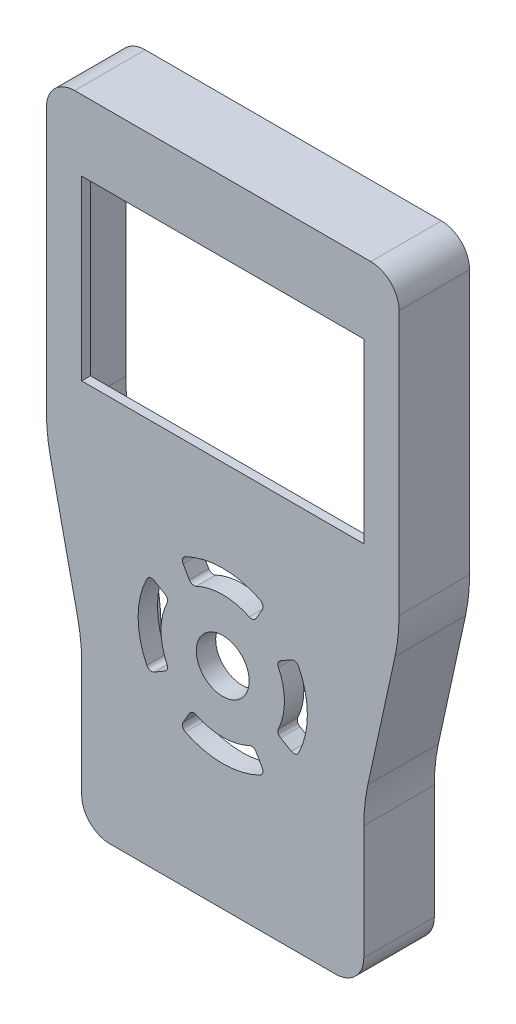
from build123d import *

# Parameters (mm, degrees)
ESBO_O1_W                = 100
ESBO_O1_H                = 180
ESBO_O1_R                = 24
ESBO_O1_W_2              = 80
ESBO_O1_H_2              = 50.3
RESSALTO_EXTRUS_O1_DEPTH = 20
CORTE_EXTRUS_O1_DEPTH    = 227.2
FILETE1_R                = 50
FILETE2_R                = 8
FILETE3_R                = 1.5
CASCA1_T                 = -2.5
CORTE_EXTRUS_O2_START    = 108.4
ESBO_O3_R                = 26.5
CORTE_EXTRUS_O2_DEPTH    = 105.4
ESBO_O4_W                = 85
ESBO_O4_H                = 55.3
CORTE_EXTRUS_O3_DEPTH    = 17.5


with BuildPart() as part:
    # Esboço1 → Ressalto-extrusão1 (new body)
    # profile 1 of 13: a face of its own
    with BuildSketch(Plane.XY):
        with Locations((50, 90)):
            Rectangle(ESBO_O1_W, ESBO_O1_H)
        with Locations((50, 59.7)):
            Circle(ESBO_O1_R, mode=Mode.SUBTRACT)
        with Locations((50, 134.85)):
            Rectangle(ESBO_O1_W_2, ESBO_O1_H_2, mode=Mode.SUBTRACT)
    # profile 2 of 13: a face of its own
    with BuildSketch(Plane.XY):
        with BuildLine():
            ThreePointArc((58.75, 74.855444566), (50, 77.2), (41.25, 74.855444566))
            Line((41.25, 74.855444566), (46.25, 66.195190528))
            ThreePointArc((46.25, 66.195190528), (50, 67.2), (53.75, 66.195190528))
            Line((53.75, 66.195190528), (58.75, 74.855444566))
        make_face()
    # profile 3 of 13: a face of its own
    with BuildSketch(Plane.XY):
        with BuildLine():
            Line((46.25, 66.195190528), (41.25, 74.855444566))
            ThreePointArc((41.25, 74.855444566), (37.625631329, 72.074368671), (34.844555434, 68.45))
            Line((34.844555434, 68.45), (43.504809472, 63.45))
            ThreePointArc((43.504809472, 63.45), (44.696699141, 65.003300859), (46.25, 66.195190528))
        make_face()
    # profile 4 of 13: a face of its own
    with BuildSketch(Plane.XY):
        with BuildLine():
            Line((43.504809472, 63.45), (34.844555434, 68.45))
            ThreePointArc((34.844555434, 68.45), (32.5, 59.7), (34.844555434, 50.95))
            Line((34.844555434, 50.95), (43.504809472, 55.95))
            ThreePointArc((43.504809472, 55.95), (42.5, 59.7), (43.504809472, 63.45))
        make_face()
    # profile 5 of 13: a face of its own
    with BuildSketch(Plane.XY):
        with BuildLine():
            Line((43.504809472, 55.95), (34.844555434, 50.95))
            ThreePointArc((34.844555434, 50.95), (37.625631329, 47.325631329), (41.25, 44.544555434))
            Line((41.25, 44.544555434), (46.25, 53.204809472))
            ThreePointArc((46.25, 53.204809472), (44.696699141, 54.396699141), (43.504809472, 55.95))
        make_face()
    # profile 6 of 13: a face of its own
    with BuildSketch(Plane.XY):
        with BuildLine():
            Line((58.75, 44.544555434), (53.75, 53.204809472))
            ThreePointArc((53.75, 53.204809472), (50, 52.2), (46.25, 53.204809472))
            Line((46.25, 53.204809472), (41.25, 44.544555434))
            ThreePointArc((41.25, 44.544555434), (50, 42.2), (58.75, 44.544555434))
        make_face()
    # profile 7 of 13: a face of its own
    with BuildSketch(Plane.XY):
        with BuildLine():
            ThreePointArc((67.5, 59.7), (66.90370196, 64.229333289), (65.155444566, 68.45))
            Line((65.155444566, 68.45), (56.495190528, 63.45))
            ThreePointArc((56.495190528, 63.45), (57.244443697, 61.641142838), (57.5, 59.7))
            ThreePointArc((57.5, 59.7), (57.244443697, 57.758857162), (56.495190528, 55.95))
            Line((56.495190528, 55.95), (65.155444566, 50.95))
            ThreePointArc((65.155444566, 50.95), (66.90370196, 55.170666711), (67.5, 59.7))
        make_face()
    # profile 8 of 13: a face of its own
    with BuildSketch(Plane.XY):
        with BuildLine():
            ThreePointArc((56.495190528, 55.95), (55.303300859, 54.396699141), (53.75, 53.204809472))
            Line((53.75, 53.204809472), (58.75, 44.544555434))
            ThreePointArc((58.75, 44.544555434), (62.374368671, 47.325631329), (65.155444566, 50.95))
            Line((65.155444566, 50.95), (56.495190528, 55.95))
        make_face()
    # profile 9 of 13: a face of its own
    with BuildSketch(Plane.XY):
        with BuildLine():
            ThreePointArc((65.155444566, 68.45), (62.374368671, 72.074368671), (58.75, 74.855444566))
            Line((58.75, 74.855444566), (53.75, 66.195190528))
            ThreePointArc((53.75, 66.195190528), (55.303300859, 65.003300859), (56.495190528, 63.45))
            Line((56.495190528, 63.45), (65.155444566, 68.45))
        make_face()
    # profile 10 of 13: a face of its own
    with BuildSketch(Plane.XY):
        with BuildLine():
            Line((41.25, 74.855444566), (38, 80.484609691))
            ThreePointArc((38, 80.484609691), (33.029437252, 76.670562748), (29.215390309, 71.7))
            Line((29.215390309, 71.7), (34.844555434, 68.45))
            ThreePointArc((34.844555434, 68.45), (37.625631329, 72.074368671), (41.25, 74.855444566))
        make_face()
    # profile 11 of 13: a face of its own
    with BuildSketch(Plane.XY):
        with BuildLine():
            Line((34.844555434, 50.95), (29.215390309, 47.7))
            ThreePointArc((29.215390309, 47.7), (33.029437252, 42.729437252), (38, 38.915390309))
            Line((38, 38.915390309), (41.25, 44.544555434))
            ThreePointArc((41.25, 44.544555434), (37.625631329, 47.325631329), (34.844555434, 50.95))
        make_face()
    # profile 12 of 13: a face of its own
    with BuildSketch(Plane.XY):
        with BuildLine():
            ThreePointArc((62, 38.915390309), (66.970562748, 42.729437252), (70.784609691, 47.7))
            Line((70.784609691, 47.7), (65.155444566, 50.95))
            ThreePointArc((65.155444566, 50.95), (62.374368671, 47.325631329), (58.75, 44.544555434))
            Line((58.75, 44.544555434), (62, 38.915390309))
        make_face()
    # profile 13 of 13: a face of its own
    with BuildSketch(Plane.XY):
        with BuildLine():
            ThreePointArc((70.784609691, 71.7), (66.970562748, 76.670562748), (62, 80.484609691))
            Line((62, 80.484609691), (58.75, 74.855444566))
            ThreePointArc((58.75, 74.855444566), (62.374368671, 72.074368671), (65.155444566, 68.45))
            Line((65.155444566, 68.45), (70.784609691, 71.7))
        make_face()
    extrude(amount=RESSALTO_EXTRUS_O1_DEPTH)

    # Esboço2 → Corte-extrusão1 (cut)
    with BuildSketch(Plane.XY.offset(20)):
        Polygon((10, 45.85), (0, 91.7), (0, 0), (10, 0), align=None)
        Polygon((90, 45.85), (90, 0), (100, 0), (100, 91.7), align=None)
    extrude(amount=-CORTE_EXTRUS_O1_DEPTH, mode=Mode.SUBTRACT)

    # Filete1
    filete1_edges = [part.edges().sort_by_distance(p)[0] for p in [
        (90, 45.85, 10),
        (0, 91.7, 10),
        (10, 45.85, 10),
        (100, 91.7, 10),
    ]]
    fillet(filete1_edges, radius=FILETE1_R)

    # Filete2
    filete2_edges = [part.edges().sort_by_distance(p)[0] for p in [
        (90, 0, 10),
        (0, 180, 10),
        (100, 180, 10),
        (10, 0, 10),
    ]]
    fillet(filete2_edges, radius=FILETE2_R)

    # Filete3
    filete3_edges = [part.edges().sort_by_distance(p)[0] for p in [
        (58.75, 74.855444566, 10),
        (62, 80.484609691, 10),
        (38, 80.484609691, 10),
        (41.25, 74.855444566, 10),
        (34.844555434, 68.45, 10),
        (29.215390309, 71.7, 10),
        (29.215390309, 47.7, 10),
        (34.844555434, 50.95, 10),
        (70.784609691, 47.7, 10),
        (70.784609691, 71.7, 10),
        (65.155444566, 68.45, 10),
        (65.155444566, 50.95, 10),
        (41.25, 44.544555434, 10),
        (38, 38.915390309, 10),
        (62, 38.915390309, 10),
        (58.75, 44.544555434, 10),
    ]]
    fillet(filete3_edges, radius=FILETE3_R)

    # Casca1
    casca1_openings = [part.faces().sort_by_distance(p)[0] for p in [
        (50, 40.944516246, 0),
    ]]
    offset(amount=CASCA1_T, openings=casca1_openings, kind=Kind.INTERSECTION)

    # Esboço3 → Corte-extrusão2 (cut)
    with BuildSketch(Plane(origin=(0, 0, 17.5), x_dir=(-1, 0, 0), z_dir=(0, 0, -1)).offset(CORTE_EXTRUS_O2_START)):
        with Locations((-50, 59.7)):
            Circle(ESBO_O3_R)
    extrude(amount=-CORTE_EXTRUS_O2_DEPTH, mode=Mode.SUBTRACT)

    # Esboço4 → Corte-extrusão3 (cut)
    with BuildSketch(Plane(origin=(0, 0, 0), x_dir=(-1, 0, 0), z_dir=(0, 0, -1))):
        with Locations((-50, 134.85)):
            Rectangle(ESBO_O4_W, ESBO_O4_H)
    extrude(amount=-CORTE_EXTRUS_O3_DEPTH, mode=Mode.SUBTRACT)


solid = part.part
